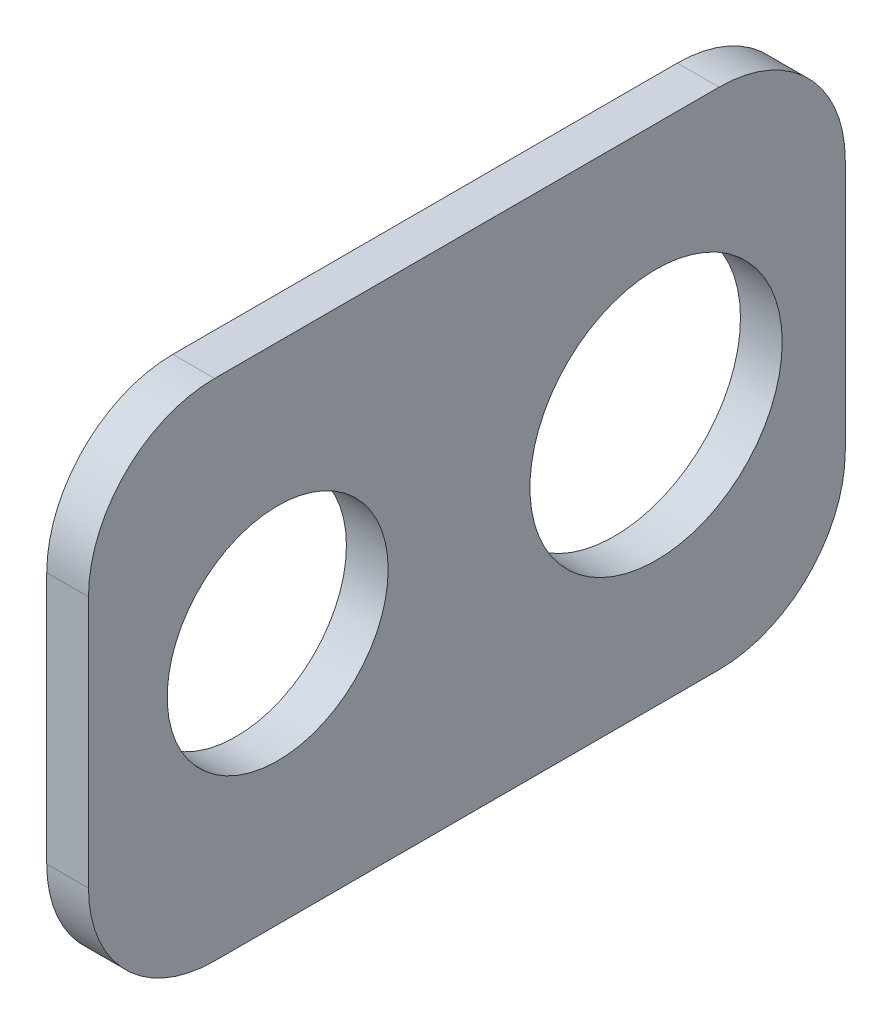
from build123d import *

# Parameters (mm, degrees)
SKETCH1_W           = 50.8
SKETCH1_H           = 76.2
BOSS_EXTRUDE1_DEPTH = 4.203048037
SKETCH3_R           = 11.1252
SKETCH3_R_2         = 12.7
CUT_EXTRUDE1_DEPTH  = 92.677399684
FILLET2_R           = 12.7


with BuildPart() as part:
    # Sketch1 → Boss-Extrude1 (new body)
    with BuildSketch(Plane.YZ):
        with Locations((25.4, 38.1)):
            Rectangle(SKETCH1_W, SKETCH1_H)
    extrude(amount=BOSS_EXTRUDE1_DEPTH)

    # Sketch3 → Cut-Extrude1 (cut, through all)
    with BuildSketch(Plane.YZ.offset(4.203048037)):
        with Locations(Location((25.4, 57.15, 0), (0, 0, 270))):
            Circle(SKETCH3_R)
        with Locations(Location((25.4, 19.05, 0), (0, 0, 270))):
            Circle(SKETCH3_R_2)
    extrude(amount=-CUT_EXTRUDE1_DEPTH, mode=Mode.SUBTRACT)

    # Fillet2
    fillet2_edges = [part.edges().sort_by_distance(p)[0] for p in [
        (2.101524019, 0, 0),
        (2.101524019, 0, 76.2),
        (2.101524019, 50.8, 76.2),
        (2.101524019, 50.8, 0),
    ]]
    fillet(fillet2_edges, radius=FILLET2_R)


solid = part.part
